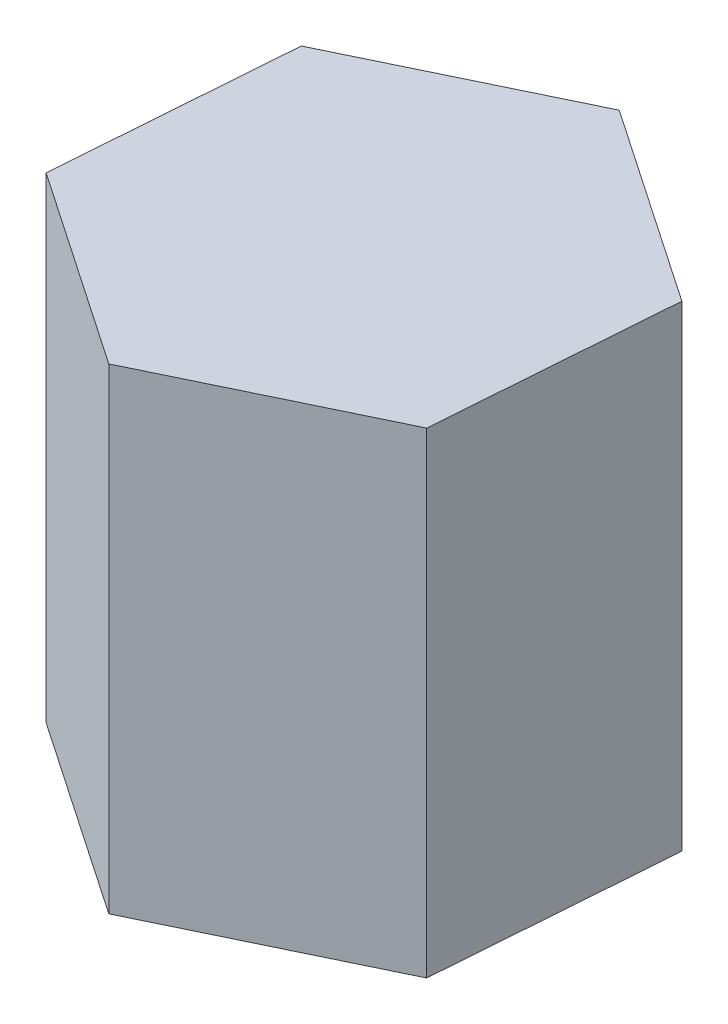
from build123d import *

# Parameters (mm, degrees)
EXTRUDE_1_DEPTH = 40


with BuildPart() as part:
    # 草图1 → 凸台-拉伸1 (new body)
    with BuildSketch(Plane(origin=(0, 0, 0), x_dir=(1, 0, 0), z_dir=(0, 1, 0))):
        Polygon((16.526627804, -11.263683831), (18.017950239, 8.680637602), (1.491322436, 19.944321432), (-16.526627804, 11.263683831), (-18.017950239, -8.680637602), (-1.491322436, -19.944321432), align=None)
    extrude(amount=EXTRUDE_1_DEPTH)


solid = part.part
